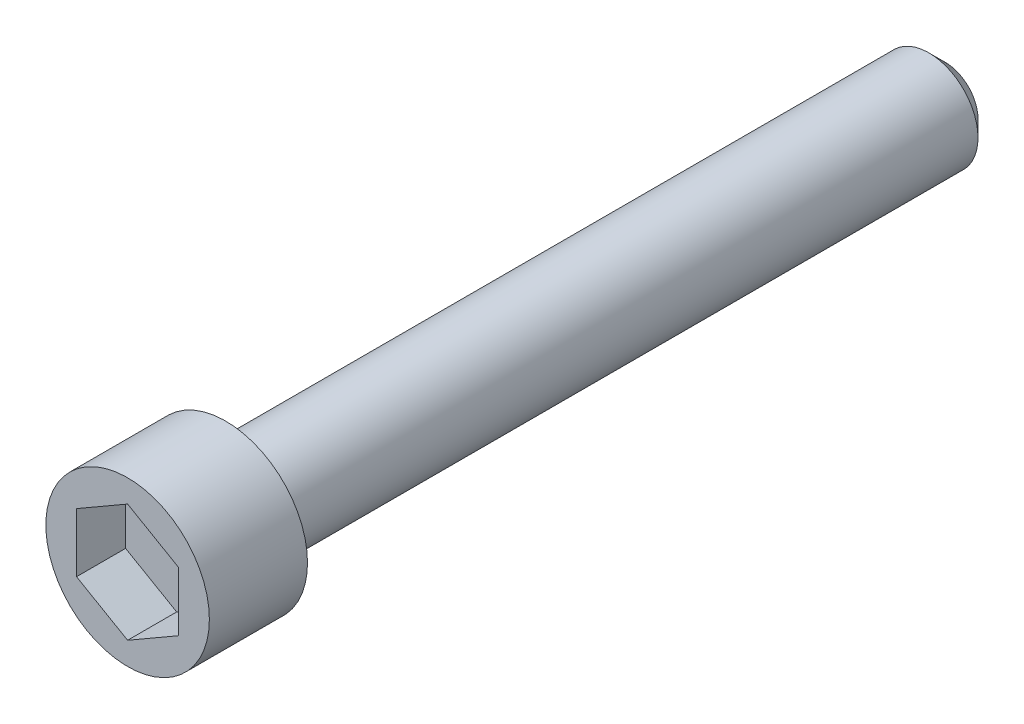
from build123d import *

# Parameters (mm, degrees)
SKETCH_1_R          = 1.5
EXTRUDE_1_DEPTH     = 22
SKETCH_2_R          = 2.5
EXTRUDE_2_DEPTH     = 3
CUT_EXTRUDE_1_DEPTH = 1.5
CHAMFER_1_SIZE      = 0.5


with BuildPart() as part:
    # 草图1 → 凸台-拉伸1 (new body)
    with BuildSketch(Plane.XY):
        Circle(SKETCH_1_R)
    extrude(amount=EXTRUDE_1_DEPTH)

    # 草图2 → 凸台-拉伸2 (add)
    with BuildSketch(Plane.XY.offset(22)):
        Circle(SKETCH_2_R)
    extrude(amount=EXTRUDE_2_DEPTH)

    # 草图3 → 切除-拉伸1 (cut)
    with BuildSketch(Plane.XY.offset(25)):
        Polygon((0, 1.803382283), (-1.56177487, 0.901691141), (-1.56177487, -0.901691141), (0, -1.803382283), (1.56177487, -0.901691141), (1.56177487, 0.901691141), align=None)
    extrude(amount=-CUT_EXTRUDE_1_DEPTH, mode=Mode.SUBTRACT)

    # 倒角1
    chamfer_1_edges = [part.edges().sort_by_distance(p)[0] for p in [
        (-1.5, 0, 0),
    ]]
    chamfer(chamfer_1_edges, length=CHAMFER_1_SIZE)


solid = part.part
